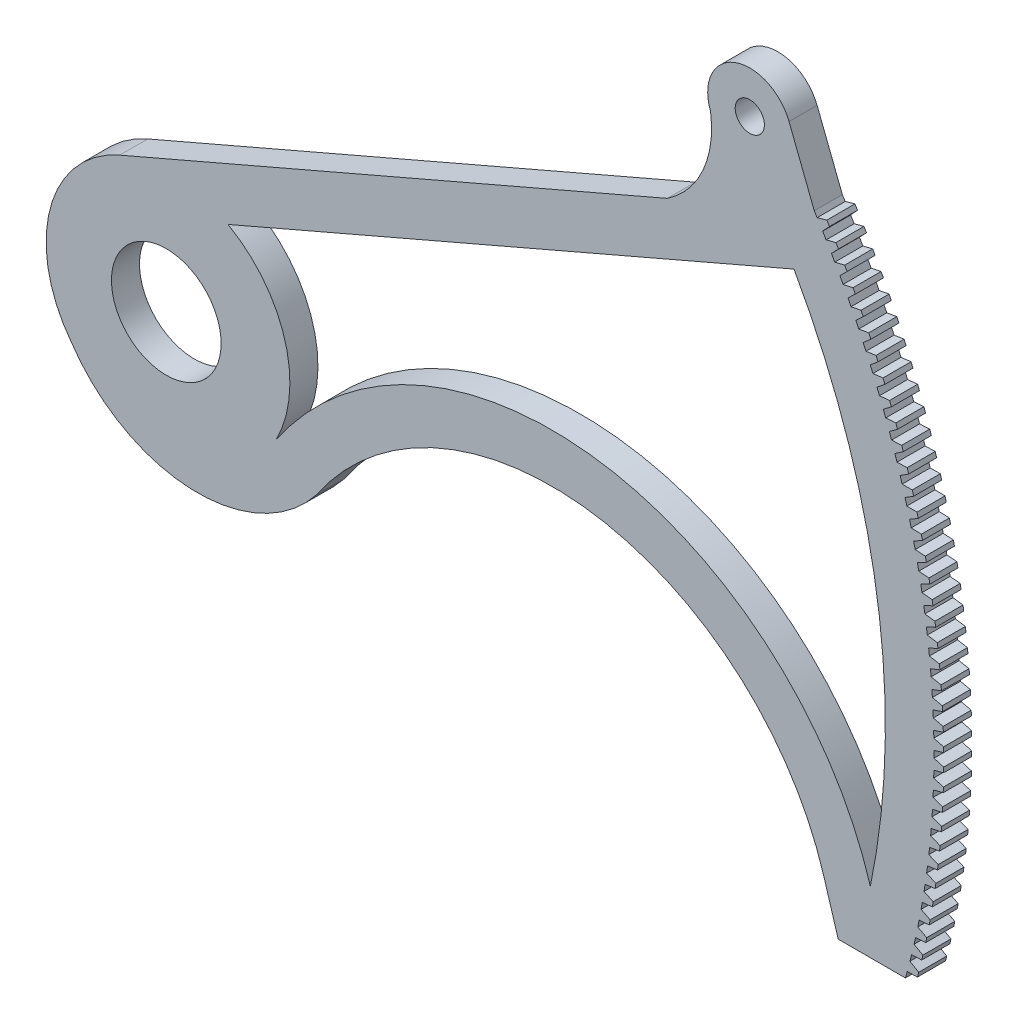
from build123d import *

# Parameters (mm, degrees)
SKETCH1_R           = 12.408212295
SKETCH1_R_2         = 3.302
BOSS_EXTRUDE1_DEPTH = 6.35


with BuildPart() as part:
    # Sketch1 → Boss-Extrude1 (new body)
    with BuildSketch(Plane(origin=(0, 0, 0), x_dir=(-1, 0, 0), z_dir=(0, 0, -1))):
        with BuildLine():
            Line((10.539485883, 25.458586117), (-113.354485872, 78.936296964))
            ThreePointArc((-113.354485872, 78.936296964), (-121.435921865, 88.480292523), (-123.16202884, 100.866495074))
            ThreePointArc((-123.16202884, 100.866495074), (-128.583573423, 113.191176173), (-140.91304048, 107.780524464))
            Line((-140.91304048, 107.780524464), (-146.633186787, 93.132961962))
            ThreePointArc((-146.633186787, 93.132961962), (-146.956062871, 92.622651964), (-147.27716299, 92.111222621))
            Line((-147.27716299, 92.111222621), (-149.484042103, 92.742363927))
            Line((-149.484042103, 92.742363927), (-150.076889657, 91.779911207))
            Line((-150.076889657, 91.779911207), (-148.521400775, 90.091251423))
            ThreePointArc((-148.521400775, 90.091251423), (-148.917928344, 89.434281397), (-149.311549889, 88.775566126))
            Line((-149.311549889, 88.775566126), (-151.53206555, 89.356913668))
            Line((-151.53206555, 89.356913668), (-152.10311697, 88.381370878))
            Line((-152.10311697, 88.381370878), (-150.510042508, 86.728122171))
            ThreePointArc((-150.510042508, 86.728122171), (-150.891694102, 86.062400165), (-151.270401156, 85.394998714))
            Line((-151.270401156, 85.394998714), (-153.503430022, 85.926258394))
            Line((-153.503430022, 85.926258394), (-154.052396417, 84.938119053))
            Line((-154.052396417, 84.938119053), (-152.422542301, 83.32111779))
            ThreePointArc((-152.422542301, 83.32111779), (-152.789124845, 82.646980588), (-153.152725822, 81.971230591))
            Line((-153.152725822, 81.971230591), (-155.39713822, 82.452133648))
            Line((-155.39713822, 82.452133648), (-155.923741872, 81.451897649))
            Line((-155.923741872, 81.451897649), (-154.257932633, 79.871961859))
            ThreePointArc((-154.257932633, 79.871961859), (-154.609260676, 79.189750502), (-154.957571632, 78.505993816))
            Line((-154.957571632, 78.505993816), (-157.212232131, 78.936296964))
            Line((-157.212232131, 78.936296964), (-157.716206636, 77.92447032))
            Line((-157.716206636, 77.92447032), (-156.015284993, 76.38239928))
            ThreePointArc((-156.015284993, 76.38239928), (-156.3511808, 75.692458895), (-156.68402553, 75.001041427))
            Line((-156.68402553, 75.001041427), (-158.947793513, 75.380526979))
            Line((-158.947793513, 75.380526979), (-159.428883912, 74.357621565))
            Line((-159.428883912, 74.357621565), (-157.69371035, 72.854195399))
            ThreePointArc((-157.69371035, 72.854195399), (-158.014003995, 72.156875021), (-158.331214113, 71.458146554))
            Line((-158.331214113, 71.458146554), (-160.602944356, 71.786622532))
            Line((-160.602944356, 71.786622532), (-161.06090727, 70.753155828))
            Line((-161.06090727, 70.753155828), (-159.292359601, 69.289135108))
            ThreePointArc((-159.292359601, 69.289135108), (-159.596889049, 68.584787506), (-159.898304081, 67.879101522))
            Line((-159.898304081, 67.879101522), (-162.176847332, 68.156401751))
            Line((-162.176847332, 68.156401751), (-162.611451081, 67.112896581))
            Line((-162.611451081, 67.112896581), (-160.810424001, 65.689021944))
            ThreePointArc((-160.810424001, 65.689021944), (-161.099035192, 64.978003443), (-161.384502654, 64.265716944))
            Line((-161.384502654, 64.265716944), (-163.668706215, 64.491701141))
            Line((-163.668706215, 64.491701141), (-164.079730936, 63.438685406))
            Line((-164.079730936, 63.438685406), (-162.247135571, 62.055677181))
            ThreePointArc((-162.247135571, 62.055677181), (-162.5196825, 61.338347479), (-162.789057976, 60.619820805))
            Line((-162.789057976, 60.619820805), (-165.077766285, 60.794374646))
            Line((-165.077766285, 60.794374646), (-165.465004044, 59.732381059))
            Line((-165.465004044, 59.732381059), (-163.60176749, 58.390938899))
            ThreePointArc((-163.60176749, 58.390938899), (-163.858112277, 57.667660889), (-164.111259493, 56.943257538))
            Line((-164.111259493, 56.943257538), (-166.403314708, 57.066292716))
            Line((-166.403314708, 57.066292716), (-166.766569603, 55.995858533))
            Line((-166.766569603, 55.995858533), (-164.873634459, 54.696661064))
            ThreePointArc((-164.873634459, 54.696661064), (-165.113647421, 53.967800647), (-165.350438311, 53.237887089))
            Line((-165.350438311, 53.237887089), (-167.644680899, 53.309341363))
            Line((-167.644680899, 53.309341363), (-167.983769163, 52.231008108))
            Line((-167.983769163, 52.231008108), (-166.06209305, 50.974712584))
            ThreePointArc((-166.06209305, 50.974712584), (-166.285652766, 50.240638486), (-166.50596754, 49.505583978))
            Line((-166.50596754, 49.505583978), (-168.801236859, 49.525421199))
            Line((-168.801236859, 49.525421199), (-169.11598695, 48.439734394))
            Line((-169.11598695, 48.439734394), (-167.166542031, 47.226976367))
            ThreePointArc((-167.166542031, 47.226976367), (-167.373535404, 46.488059949), (-167.577262605, 45.748236351))
            Line((-167.577262605, 45.748236351), (-169.872397496, 45.716446484))
            Line((-169.872397496, 45.716446484), (-170.162650183, 44.623955369))
            Line((-170.162650183, 44.623955369), (-168.186422668, 43.455348363))
            ThreePointArc((-168.186422668, 43.455348363), (-168.376744981, 42.711963439), (-168.563781546, 41.967745022))
            Line((-168.563781546, 41.967745022), (-170.857620917, 41.884344149))
            Line((-170.857620917, 41.884344149), (-171.123229364, 40.785601408))
            Line((-171.123229364, 40.785601408), (-169.121219012, 39.661736614))
            ThreePointArc((-169.121219012, 39.661736614), (-169.294773983, 38.914259256), (-169.46502529, 38.166022515))
            Line((-169.46502529, 38.166022515), (-171.756408704, 38.031052828))
            Line((-171.756408704, 38.031052828), (-171.997238542, 36.926614306))
            Line((-171.997238542, 36.926614306), (-169.970458155, 35.848060279))
            ThreePointArc((-169.970458155, 35.848060279), (-170.127157984, 35.096868631), (-170.280537906, 34.344992093))
            Line((-170.280537906, 34.344992093), (-172.568306168, 34.158521873))
            Line((-172.568306168, 34.158521873), (-172.784235562, 33.048946298))
            Line((-172.784235562, 33.048946298), (-170.733710474, 32.01624867))
            ThreePointArc((-170.733710474, 32.01624867), (-170.873475887, 31.261722754), (-171.009906829, 30.506586788))
            Line((-171.009906829, 30.506586788), (-173.292902575, 30.268710368))
            Line((-173.292902575, 30.268710368), (-173.483822288, 29.154559067))
            Line((-173.483822288, 29.154559067), (-171.410589846, 28.168240273))
            ThreePointArc((-171.410589846, 28.168240273), (-171.533350136, 27.410761798), (-171.652763079, 26.652748422))
            Line((-171.652763079, 26.652748422), (-173.929831357, 26.363586142))
            Line((-173.929831357, 26.363586142), (-174.095644805, 25.245422756))
            Line((-174.095644805, 25.245422756), (-172.00075384, 24.305981767))
            ThreePointArc((-172.00075384, 24.305981767), (-172.106446905, 23.545933936), (-172.208781439, 22.785426624))
            Line((-172.208781439, 22.785426624), (-174.478770297, 22.445124769))
            Line((-174.478770297, 22.445124769), (-174.619393595, 21.323514968))
            Line((-174.619393595, 21.323514968), (-172.503903899, 20.431427041))
            ThreePointArc((-172.503903899, 20.431427041), (-172.592476269, 19.669194357), (-172.677680624, 18.906577843))
            Line((-172.677680624, 18.906577843), (-174.93944169, 18.51530857))
            Line((-174.93944169, 18.51530857), (-175.054803699, 17.390819768))
            Line((-175.054803699, 17.390819768), (-172.919785481, 16.546536203))
            ThreePointArc((-172.919785481, 16.546536203), (-172.991192348, 15.782504275), (-173.059223419, 15.018164362))
            Line((-173.059223419, 15.018164362), (-175.311612486, 14.57612561))
            Line((-175.311612486, 14.57612561), (-175.401654844, 13.449326678))
            Line((-175.401654844, 13.449326678), (-173.248188196, 12.653274593))
            ThreePointArc((-173.248188196, 12.653274593), (-173.302393436, 11.887829937), (-173.353216807, 11.1221533))
            Line((-173.353216807, 11.1221533), (-175.595094406, 10.629568694))
            Line((-175.595094406, 10.629568694), (-175.659771562, 9.501029672))
            Line((-175.659771562, 9.501029672), (-173.488945907, 8.753611783))
            ThreePointArc((-173.488945907, 8.753611783), (-173.525922098, 7.987141633), (-173.559512057, 7.220515621))
            Line((-173.559512057, 7.220515621), (-175.78974404, 6.677634356))
            Line((-175.78974404, 6.677634356), (-175.829023274, 5.547926163))
            Line((-175.829023274, 5.547926163), (-173.641936816, 4.849520584))
            ThreePointArc((-173.641936816, 4.849520584), (-173.661665251, 4.082412692), (-173.678004807, 3.315225135))
            Line((-173.678004807, 3.315225135), (-175.895462915, 2.722321851))
            Line((-175.895462915, 2.722321851), (-175.909324356, 1.592015998))
            Line((-175.909324356, 1.592015998), (-173.707083527, 0.942976048))
            ThreePointArc((-173.707083527, 0.942976048), (-173.709554226, 0.175618488), (-173.708635111, -0.591742499))
            Line((-173.708635111, -0.591742499), (-175.912197548, -1.234367857))
            Line((-175.912197548, -1.234367857), (-175.900634184, -2.364699555))
            Line((-175.900634184, -2.364699555), (-173.684353082, -2.964045534))
            ThreePointArc((-173.684353082, -2.964045534), (-173.669564795, -3.731264561), (-173.651387474, -4.498410775))
            Line((-173.651387474, -4.498410775), (-175.839939474, -5.190433107))
            Line((-175.839939474, -5.190433107), (-175.802957154, -6.320218825))
            Line((-175.802957154, -6.320218825), (-173.573756979, -6.869567626))
            ThreePointArc((-173.573756979, -6.869567626), (-173.541717188, -7.636259989), (-173.506290858, -8.402803337))
            Line((-173.506290858, -8.402803337), (-175.678725248, -9.143872555))
            Line((-175.678725248, -9.143872555), (-175.616342682, -10.272540741))
            Line((-175.616342682, -10.272540741), (-173.37535117, -10.771614453))
            ThreePointArc((-173.37535117, -10.771614453), (-173.326076083, -11.537392289), (-173.273418666, -12.302944982))
            Line((-173.273418666, -12.302944982), (-175.428636427, -13.092686184))
            Line((-175.428636427, -13.092686184), (-175.340885173, -14.219665854))
            Line((-175.340885173, -14.219665854), (-173.089236026, -14.668211999))
            ThreePointArc((-173.089236026, -14.668211999), (-173.022750571, -15.432687906), (-172.952888705, -16.196862656))
            Line((-172.952888705, -16.196862656), (-175.089799529, -17.034876317))
            Line((-175.089799529, -17.034876317), (-174.97672398, -18.15959734))
            Line((-174.97672398, -18.15959734), (-172.71555629, -18.557389002))
            ThreePointArc((-172.71555629, -18.557389002), (-172.631894102, -19.320176238), (-172.54486313, -20.082586455))
            Line((-172.54486313, -20.082586455), (-174.662385969, -20.96844863))
            Line((-174.662385969, -20.96844863), (-174.524043328, -22.090342018))
            Line((-174.524043328, -22.090342018), (-172.254501005, -22.437177957))
            ThreePointArc((-172.254501005, -22.437177957), (-172.153704408, -23.197890633), (-172.049548358, -23.958150618))
            Line((-172.049548358, -23.958150618), (-174.146611972, -24.891413157))
            Line((-174.146611972, -24.891413157), (-173.983072227, -26.009911351))
            Line((-173.983072227, -26.009911351), (-171.706303415, -26.305616106))
            ThreePointArc((-171.706303415, -26.305616106), (-171.588423401, -27.063869382), (-171.467194965, -27.821594527))
            Line((-171.467194965, -27.821594527), (-173.542738465, -28.801785297))
            Line((-173.542738465, -28.801785297), (-173.35408435, -29.916322459))
            Line((-173.35408435, -29.916322459), (-171.07124085, -30.160746434))
            ThreePointArc((-171.07124085, -30.160746434), (-170.936337053, -30.916156716), (-170.79809756, -31.670963692))
            Line((-170.79809756, -31.670963692), (-172.851070943, -32.697586824))
            Line((-172.851070943, -32.697586824), (-172.637397896, -33.807599116))
            Line((-172.637397896, -33.807599116), (-170.349634582, -34.000618659))
            ThreePointArc((-170.349634582, -34.000618659), (-170.19777525, -34.75280379), (-170.042594634, -35.504310746))
            Line((-170.042594634, -35.504310746), (-172.071959316, -36.576846877))
            Line((-172.071959316, -36.576846877), (-171.833375432, -37.681772753))
            Line((-171.833375432, -37.681772753), (-169.541849667, -37.823290216))
            ThreePointArc((-169.541849667, -37.823290216), (-169.373111624, -38.571869672), (-169.20106839, -39.319696427))
            Line((-169.20106839, -39.319696427), (-171.20579773, -40.437602969))
            Line((-171.20579773, -40.437602969), (-170.942423708, -41.536883454))
            Line((-170.942423708, -41.536883454), (-168.648294758, -41.626827246))
            ThreePointArc((-168.648294758, -41.626827246), (-168.462763368, -42.371422325), (-168.27394455, -43.115190557))
            Line((-168.27394455, -43.115190557), (-170.25302437, -44.27790197))
            Line((-170.25302437, -44.27790197), (-169.964993449, -45.370980946))
            Line((-169.964993449, -45.370980946), (-167.669421897, -45.409305565))
            ThreePointArc((-167.669421897, -45.409305565), (-167.466164791, -46.153263388), (-167.259606723, -46.896311475))
            Line((-167.259606723, -46.896311475), (-152.054130393, -46.896311475))
            Line((-152.054130393, -46.896311475), (-148.767258454, -36.099192633))
            ThreePointArc((-148.767258454, -36.099192633), (-96.785878161, 8.760995722), (-33.940593142, -18.897105216))
            ThreePointArc((-33.940593142, -18.897105216), (-5.658002222, -31.885433701), (21.487058667, -16.662185184))
            ThreePointArc((21.487058667, -16.662185184), (26.30414767, 7.072892878), (10.539485883, 25.458586117))
        make_face()
        with Locations(Location((0, 0, 0), (0, 0, 180))):
            Circle(SKETCH1_R, mode=Mode.SUBTRACT)
        with Locations(Location((-132.040589467, 104.315666888, 0), (0, 0, 180))):
            Circle(SKETCH1_R_2, mode=Mode.SUBTRACT)
        with BuildLine():
            Line((-142.041347589, 79.412448473), (-13.981610582, 24.136622782))
            ThreePointArc((-13.981610582, 24.136622782), (-26.860070669, 7.893841022), (-24.78957164, -12.731282669))
            ThreePointArc((-24.78957164, -12.731282669), (-98.420693279, 19.673646259), (-159.323390025, -32.88568233))
            ThreePointArc((-159.323390025, -32.88568233), (-160.828595467, 24.824829539), (-142.041347589, 79.412448473))
        make_face(mode=Mode.SUBTRACT)
    extrude(amount=-BOSS_EXTRUDE1_DEPTH)


solid = part.part
